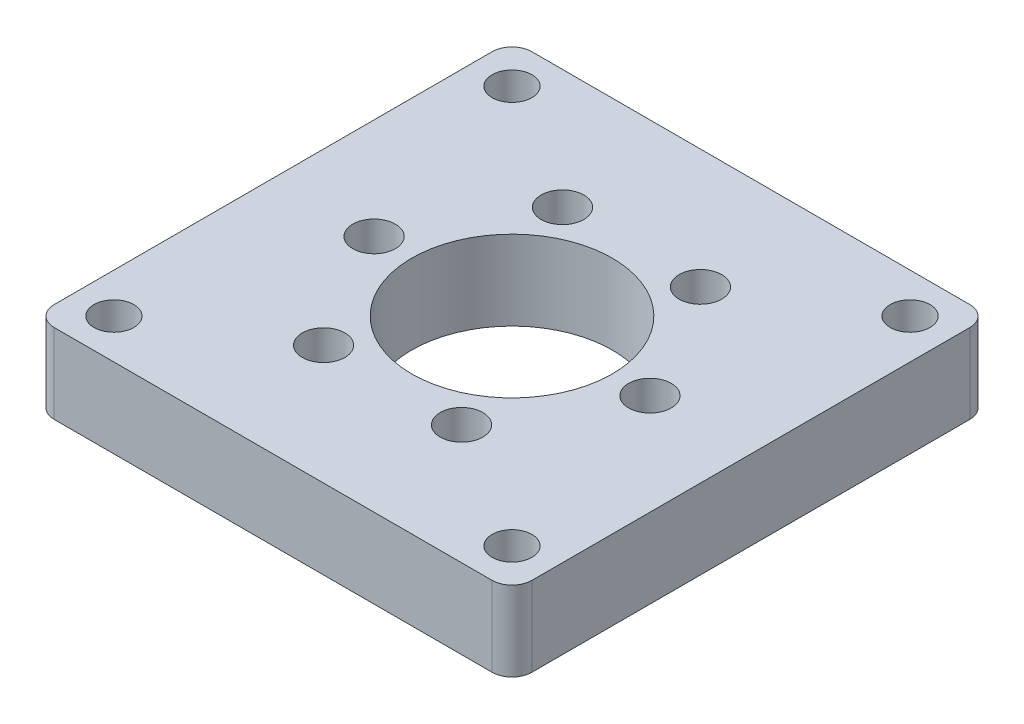
from build123d import *

# Parameters (mm, degrees)
SKETCH1_W            = 38.1
SKETCH1_H            = 38.1
BOSS_EXTRUDE1_DEPTH  = 6.35
SKETCH5_R            = 8
CUT_EXTRUDE1_DEPTH   = 55.254423783
M3_CLEARANCE_HOLE1_D = 3.4
SKETCH6_R            = 1.5875
CUT_EXTRUDE2_DEPTH   = 55.254423783
FILLET1_R            = 1.5875


with BuildPart() as part:
    # Sketch1 → Boss-Extrude1 (new body)
    with BuildSketch(Plane(origin=(0, 0, 0), x_dir=(1, 0, 0), z_dir=(0, 1, 0))):
        with Locations((-19.05, -19.05)):
            Rectangle(SKETCH1_W, SKETCH1_H)
    extrude(amount=BOSS_EXTRUDE1_DEPTH)

    # Sketch5 → Cut-Extrude1 (cut, through all)
    with BuildSketch(Plane(origin=(0, 6.35, 0), x_dir=(1, 0, 0), z_dir=(0, 1, 0))):
        with Locations(Location((-19.05, -19.05, 0), (0, 0, 270))):
            Circle(SKETCH5_R)
    extrude(amount=-CUT_EXTRUDE1_DEPTH, mode=Mode.SUBTRACT)

    # M3 Clearance Hole1 (through all)
    with Locations(Plane(origin=(0, 6.35, 0), x_dir=(-1, 0, 0), z_dir=(0, 1, 0))):
        with Locations((30.05074, 19.05), (24.55037, 9.5230797), (13.54963, 9.5230797), (8.04926, 19.05), (13.54963, 28.5769203), (24.55037, 28.5769203)):
            Hole(M3_CLEARANCE_HOLE1_D / 2)

    # Sketch6 → Cut-Extrude2 (cut, through all)
    with BuildSketch(Plane(origin=(0, 6.35, 0), x_dir=(1, 0, 0), z_dir=(0, 1, 0))):
        with Locations(Location((-34.925, -3.175, 0), (0, 0, 270))):
            Circle(SKETCH6_R)
        with Locations(Location((-3.175, -3.175, 0), (0, 0, 90))):
            Circle(SKETCH6_R)
        with Locations(Location((-3.175, -34.925, 0), (0, 0, 270))):
            Circle(SKETCH6_R)
        with Locations(Location((-34.925, -34.925, 0), (0, 0, 90))):
            Circle(SKETCH6_R)
    extrude(amount=-CUT_EXTRUDE2_DEPTH, mode=Mode.SUBTRACT)

    # Fillet1
    fillet1_edges = [part.edges().sort_by_distance(p)[0] for p in [
        (0, 3.175, 38.1),
        (-38.1, 3.175, 38.1),
        (-38.1, 3.175, 0),
        (0, 3.175, 0),
    ]]
    fillet(fillet1_edges, radius=FILLET1_R)


solid = part.part
